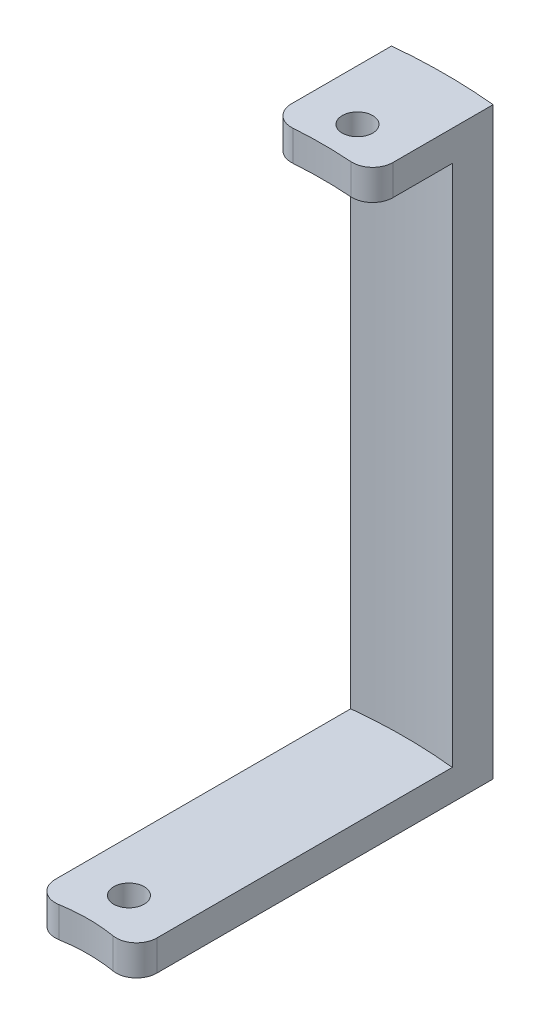
from build123d import *

# Parameters (mm, degrees)
SKETCH1_R           = 1.5
BOSS_EXTRUDE1_DEPTH = 3
BOSS_EXTRUDE2_START = 51.5
BOSS_EXTRUDE2_DEPTH = 51.5
BOSS_EXTRUDE3_START = 54.5
SKETCH1_4_R         = 1.5
BOSS_EXTRUDE3_DEPTH = 3
FILLET1_R           = 2


with BuildPart() as part:
    # Sketch1 → Boss-Extrude1 (new body)
    with BuildSketch(Plane(origin=(0, 0, 0), x_dir=(1, 0, 0), z_dir=(0, 1, 0))):
        with BuildLine():
            ThreePointArc((5, 50.854793284), (0, 51.1), (-5, 50.854793284))
            Line((-5, 50.854793284), (-5, 15.198684154))
            ThreePointArc((-5, 15.198684154), (0, 16), (5, 15.198684154))
            Line((5, 15.198684154), (5, 50.854793284))
        make_face()
        with Locations((0, 20)):
            Circle(SKETCH1_R, mode=Mode.SUBTRACT)
    extrude(amount=-BOSS_EXTRUDE1_DEPTH)

    # Sketch1<3> → Boss-Extrude2 (add)
    with BuildSketch(Plane(origin=(0, 0, 0), x_dir=(1, 0, 0), z_dir=(0, 1, 0)).offset(BOSS_EXTRUDE2_START)):
        with BuildLine():
            ThreePointArc((5, 50.854793284), (0, 51.1), (-5, 50.854793284))
            Line((-5, 50.854793284), (-5, 46.833855276))
            ThreePointArc((-5, 46.833855276), (0, 47.1), (5, 46.833855276))
            Line((5, 46.833855276), (5, 50.854793284))
        make_face()
    extrude(amount=-BOSS_EXTRUDE2_DEPTH)

    # Sketch1<4> → Boss-Extrude3 (add)
    with BuildSketch(Plane(origin=(0, 0, 0), x_dir=(1, 0, 0), z_dir=(0, 1, 0)).offset(BOSS_EXTRUDE3_START)):
        with BuildLine():
            ThreePointArc((5, 50.854793284), (0, 51.1), (-5, 50.854793284))
            Line((-5, 50.854793284), (-5, 38.778989157))
            ThreePointArc((-5, 38.778989157), (0, 39.1), (5, 38.778989157))
            Line((5, 38.778989157), (5, 50.854793284))
        make_face()
        with Locations((0, 42.5)):
            Circle(SKETCH1_4_R, mode=Mode.SUBTRACT)
    extrude(amount=-BOSS_EXTRUDE3_DEPTH)

    # Fillet1
    fillet1_edges = [part.edges().sort_by_distance(p)[0] for p in [
        (-5, 53, -38.778989157),
        (5, 53, -38.778989157),
        (5, -1.5, -15.198684154),
        (-5, -1.5, -15.198684154),
    ]]
    fillet(fillet1_edges, radius=FILLET1_R)


solid = part.part
